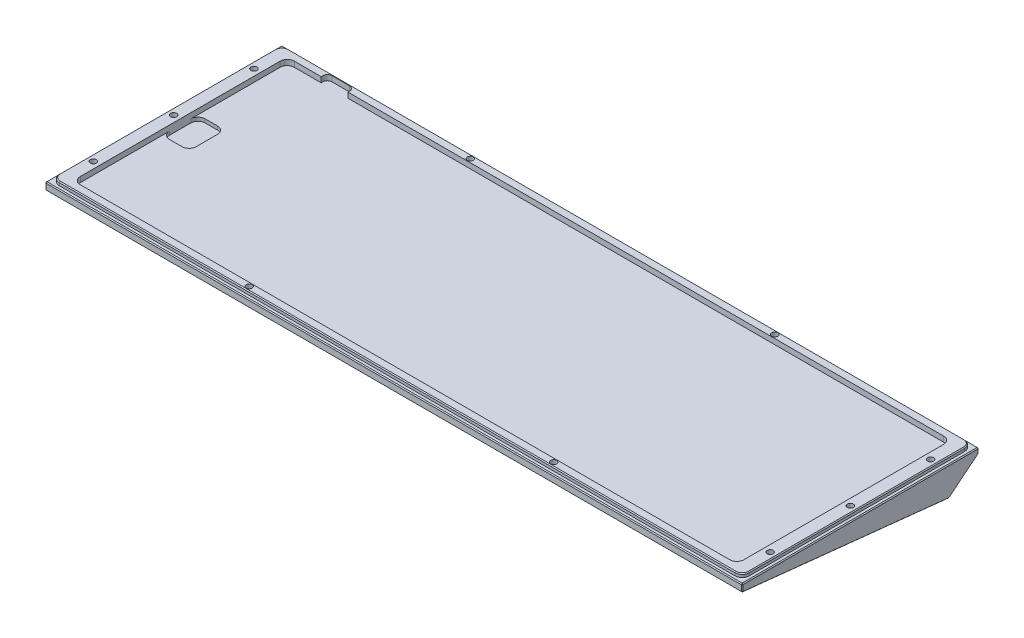
from build123d import *
from OCP.BRepFilletAPI import BRepFilletAPI_MakeChamfer

# Parameters (mm, degrees)
SKETCH1_W            = 390.7
SKETCH1_H            = 132.7
MAINBODY_DEPTH       = 18.5
SKETCH2_W            = 390.7
SKETCH2_H            = 132.7
SKETCH2_W_2          = 386.7
SKETCH2_H_2          = 128.7
ALIGMENTLIP_DEPTH    = 2
TYPINGANGLE_DEPTH    = 414.035143783
SKETCH4_W            = 372
SKETCH4_H            = 120
PCBCUTOUT_DEPTH      = 3
M3_CLEARANCE_HOLE1_D = 3.4
CUT_EXTRUDE2_START   = -1
SKETCH11_R           = 3.25
CUT_EXTRUDE2_DEPTH   = 412.911649145
SKETCH12_W           = 15
SKETCH12_H           = 3.5
CUT_EXTRUDE3_DEPTH   = 3
FILLET1_R            = 2.5
SKETCH13_W           = 15
SKETCH13_H           = 20
CUT_EXTRUDE4_DEPTH   = 2
FILLET2_R            = 4
CHAMFER1_SIZE        = 0.5
CHAMFER1_SIZE2       = 0.561801899
CHAMFER2_SIZE        = 0.5
SKETCH17_R           = 1
SKETCH17_W           = 2
SKETCH17_H           = 2
CUT_EXTRUDE5_DEPTH   = 1


with BuildPart() as part:
    # Sketch1 → MainBody (new body)
    with BuildSketch(Plane(origin=(0, 0, 0), x_dir=(1, 0, 0), z_dir=(0, 1, 0))):
        with Locations((195.35, 66.35)):
            Rectangle(SKETCH1_W, SKETCH1_H)
    extrude(amount=MAINBODY_DEPTH)

    # Sketch2 → AligmentLip (cut)
    with BuildSketch(Plane(origin=(0, 18.5, 0), x_dir=(1, 0, 0), z_dir=(0, 1, 0))):
        with Locations((195.35, 66.35)):
            Rectangle(SKETCH2_W, SKETCH2_H)
        with Locations((195.35, 66.35)):
            Rectangle(SKETCH2_W_2, SKETCH2_H_2, mode=Mode.SUBTRACT)
    extrude(amount=-ALIGMENTLIP_DEPTH, mode=Mode.SUBTRACT)

    # Sketch3 → TypingAngle (cut, through all)
    with BuildSketch(Plane.ZY):
        Polygon((-116.028888387, 0), (-132.7, 13.5), (-132.7, 0), align=None)
        Polygon((0, 12.195127583), (-116.028888387, 0), (0, 0), align=None)
    extrude(amount=-TYPINGANGLE_DEPTH, mode=Mode.SUBTRACT)

    # Sketch4 → PCBCutout (cut)
    with BuildSketch(Plane(origin=(0, 18.5, 0), x_dir=(1, 0, 0), z_dir=(0, 1, 0))):
        with Locations((195.35, 66.35)):
            Rectangle(SKETCH4_W, SKETCH4_H)
    extrude(amount=-PCBCUTOUT_DEPTH, mode=Mode.SUBTRACT)

    # M3 Clearance Hole1 (through all)
    with Locations(Plane(origin=(110, 18.5, -128.3), x_dir=(0, 0, 1), z_dir=(0, 1, 0))):
        with Locations((0, 0), (16.95, -104.3), (61.95, -104.3), (106.95, -104.3), (123.9, 0), (0, 170.7), (123.9, 170.7), (106.95, 275), (61.95, 275), (16.95, 275)):
            Hole(M3_CLEARANCE_HOLE1_D / 2)

    # Sketch11 → Cut-Extrude2 (cut, through all)
    with BuildSketch(Plane(origin=(0, 15.5, 0), x_dir=(1, 0, 0), z_dir=(0, 1, 0)).offset(CUT_EXTRUDE2_START)):
        with Locations(Location((110, 128.3, 0), (0, 0, 270))):
            Circle(SKETCH11_R)
        with Locations(Location((5.7, 111.35, 0), (0, 0, 270))):
            Circle(SKETCH11_R)
        with Locations(Location((5.7, 66.35, 0), (0, 0, 270))):
            Circle(SKETCH11_R)
        with Locations(Location((5.7, 21.35, 0), (0, 0, 270))):
            Circle(SKETCH11_R)
        with Locations(Location((110, 4.4, 0), (0, 0, 270))):
            Circle(SKETCH11_R)
        with Locations(Location((280.7, 4.4, 0), (0, 0, 270))):
            Circle(SKETCH11_R)
        with Locations(Location((385, 21.35, 0), (0, 0, 270))):
            Circle(SKETCH11_R)
        with Locations(Location((385, 66.35, 0), (0, 0, 270))):
            Circle(SKETCH11_R)
        with Locations(Location((385, 111.35, 0), (0, 0, 270))):
            Circle(SKETCH11_R)
        with Locations(Location((280.7, 128.3, 0), (0, 0, 90))):
            Circle(SKETCH11_R)
    extrude(amount=-CUT_EXTRUDE2_DEPTH, mode=Mode.SUBTRACT)

    # Sketch12 → Cut-Extrude3 (cut)
    with BuildSketch(Plane(origin=(0, 18.5, 0), x_dir=(1, 0, 0), z_dir=(0, 1, 0))):
        with Locations((35.9, 128.1)):
            Rectangle(SKETCH12_W, SKETCH12_H)
    extrude(amount=-CUT_EXTRUDE3_DEPTH, mode=Mode.SUBTRACT)

    # Fillet1
    fillet1_edges = [part.edges().sort_by_distance(p)[0] for p in [
        (28.4, 17, -129.85),
        (43.4, 17, -129.85),
    ]]
    fillet(fillet1_edges, radius=FILLET1_R)

    # Sketch13 → Cut-Extrude4 (cut)
    with BuildSketch(Plane(origin=(0, 15.5, 0), x_dir=(1, 0, 0), z_dir=(0, 1, 0))):
        with Locations((16.85, 66.35)):
            Rectangle(SKETCH13_W, SKETCH13_H)
    extrude(amount=-CUT_EXTRUDE4_DEPTH, mode=Mode.SUBTRACT)

    # Fillet2
    fillet2_edges = [part.edges().sort_by_distance(p)[0] for p in [
        (388.7, 17.5, -130.7),
        (2, 17.5, -130.7),
        (2, 17.5, -2),
        (388.7, 17.5, -2),
        (9.35, 14.5, -56.35),
        (9.35, 14.5, -76.35),
        (24.35, 14.5, -76.35),
        (24.35, 14.5, -56.35),
        (9.35, 17, -6.35),
        (9.35, 17, -126.35),
        (381.35, 17, -126.35),
        (381.35, 17, -6.35),
    ]]
    fillet(fillet2_edges, radius=FILLET2_R)

    # Chamfer1: one chamfer whose edges measure the first distance from different faces: ONE call of the kernel's chamfer builder (chamfer() names one face for all edges)
    chamfer1_edges_1 = [part.edges().sort_by_distance(p)[0] for p in [
        (0, 15, -132.7),
        (390.7, 15, -132.7),
        (390.7, 14.347563791, 0),
        (0, 14.347563791, 0),
        (195.35, 16.5, -132.7),
        (390.7, 16.5, -66.35),
        (195.35, 16.5, 0),
        (0, 16.5, -66.35),
        (0, 6.75, -124.364444193),
        (390.7, 6.75, -124.364444193),
        (0, 6.097563791, -58.014444193),
        (390.7, 6.097563791, -58.014444193),
    ]]
    chamfer1_edges_2 = [part.edges().sort_by_distance(p)[0] for p in [
        (195.35, 12.195127583, 0),
    ]]
    chamfer1_side_2 = [part.faces().sort_by_distance(p)[0] for p in [
        (195.35, 14.347563791, 0),
    ]]
    chamfer1 = BRepFilletAPI_MakeChamfer(part.part.solid().wrapped)
    for e in chamfer1_edges_1:
        chamfer1.Add(CHAMFER1_SIZE, e.wrapped)
    for e in chamfer1_edges_2:
        chamfer1.Add(CHAMFER1_SIZE, CHAMFER1_SIZE2, e.wrapped, chamfer1_side_2[0].wrapped)  # the first distance lies on this face
    add(Compound.cast(chamfer1.Shape()), mode=Mode.REPLACE)

    # Chamfer2
    chamfer2_edges = [part.edges().sort_by_distance(p)[0] for p in [
        (388.7, 18.5, -66.35),
        (195.35, 18.5, -130.7),
        (2, 18.5, -66.35),
        (195.35, 18.5, -2),
        (3.171572875, 18.5, -129.528427125),
        (3.171572875, 18.5, -3.171572875),
        (387.528427125, 18.5, -3.171572875),
        (387.528427125, 18.5, -129.528427125),
    ]]
    chamfer(chamfer2_edges, length=CHAMFER2_SIZE)

    # Sketch17 → Cut-Extrude5 (cut)
    with BuildSketch(Plane(origin=(0, 12.061881184, -1.267754798), x_dir=(1, 0, 0), z_dir=(0, -0.9945218953682734, 0.10452846326765429))):
        with Locations((205.1, -52.225262054)):
            Circle(SKETCH17_R)
        with BuildLine():
            ThreePointArc((204.1, -52.225262054), (205.1, -51.225262054), (206.1, -52.225262054))
            Line((206.1, -52.225262054), (206.1, -49.725262054))
            ThreePointArc((206.1, -49.725262054), (205.1, -50.725262054), (204.1, -49.725262054))
            Line((204.1, -49.725262054), (204.1, -52.225262054))
        make_face()
        with Locations((205.1, -49.725262054)):
            Circle(SKETCH17_R)
        with Locations((201.6, -49.725262054)):
            Circle(SKETCH17_R)
        with BuildLine():
            ThreePointArc((200.6, -60.225262054), (201.6, -59.225262054), (202.6, -60.225262054))
            Line((202.6, -60.225262054), (202.6, -49.725262054))
            ThreePointArc((202.6, -49.725262054), (201.6, -50.725262054), (200.6, -49.725262054))
            Line((200.6, -49.725262054), (200.6, -60.225262054))
        make_face()
        with Locations((201.6, -60.225262054)):
            Circle(SKETCH17_R)
        with Locations((197.1, -53.725262054)):
            Circle(SKETCH17_R)
        with BuildLine():
            Line((196.1, -62.725262054), (198.1, -62.725262054))
            Line((198.1, -62.725262054), (198.1, -53.725262054))
            ThreePointArc((198.1, -53.725262054), (197.1, -54.725262054), (196.1, -53.725262054))
            Line((196.1, -53.725262054), (196.1, -62.725262054))
        make_face()
        with Locations((197.1, -63.725262054)):
            Rectangle(SKETCH17_W, SKETCH17_H)
        with BuildLine():
            ThreePointArc((196.1, -67.725262054), (197.1, -66.725262054), (198.1, -67.725262054))
            Line((198.1, -67.725262054), (198.1, -64.725262054))
            Line((198.1, -64.725262054), (196.1, -64.725262054))
            Line((196.1, -64.725262054), (196.1, -67.725262054))
        make_face()
        with Locations((197.1, -67.725262054)):
            Circle(SKETCH17_R)
        with BuildLine():
            Line((194.1, -64.725262054), (196.1, -64.725262054))
            Line((196.1, -64.725262054), (196.1, -62.725262054))
            Line((196.1, -62.725262054), (194.1, -62.725262054))
            ThreePointArc((194.1, -62.725262054), (194.807106781, -63.018155273), (195.1, -63.725262054))
            ThreePointArc((195.1, -63.725262054), (194.807106781, -64.432368836), (194.1, -64.725262054))
        make_face()
        with Locations((194.1, -63.725262054)):
            Circle(SKETCH17_R)
        with Locations(Location((201.6, -63.725262054, 0), (0, 0, 270))):
            Circle(SKETCH17_R)
        with Locations((192.6, -60.225262054)):
            Circle(SKETCH17_R)
        with BuildLine():
            ThreePointArc((191.6, -60.225262054), (192.6, -59.225262054), (193.6, -60.225262054))
            Line((193.6, -60.225262054), (193.6, -54.225262054))
            ThreePointArc((193.6, -54.225262054), (192.6, -55.225262054), (191.6, -54.225262054))
            Line((191.6, -54.225262054), (191.6, -60.225262054))
        make_face()
        with Locations((192.6, -54.225262054)):
            Circle(SKETCH17_R)
        with BuildLine():
            ThreePointArc((188.1, -60.225262054), (189.1, -59.225262054), (190.1, -60.225262054))
            Line((190.1, -60.225262054), (190.1, -54.225262054))
            ThreePointArc((190.1, -54.225262054), (189.1, -55.225262054), (188.1, -54.225262054))
            Line((188.1, -54.225262054), (188.1, -60.225262054))
        make_face()
        with Locations((189.1, -60.225262054)):
            Circle(SKETCH17_R)
        with Locations((189.1, -54.225262054)):
            Circle(SKETCH17_R)
        with Locations((185.6, -54.225262054)):
            Circle(SKETCH17_R)
        with BuildLine():
            ThreePointArc((184.6, -60.225262054), (185.6, -59.225262054), (186.6, -60.225262054))
            Line((186.6, -60.225262054), (186.6, -54.225262054))
            ThreePointArc((186.6, -54.225262054), (185.6, -55.225262054), (184.6, -54.225262054))
            Line((184.6, -54.225262054), (184.6, -60.225262054))
        make_face()
        with Locations((185.6, -60.225262054)):
            Circle(SKETCH17_R)
    extrude(amount=-CUT_EXTRUDE5_DEPTH, mode=Mode.SUBTRACT)


solid = part.part
